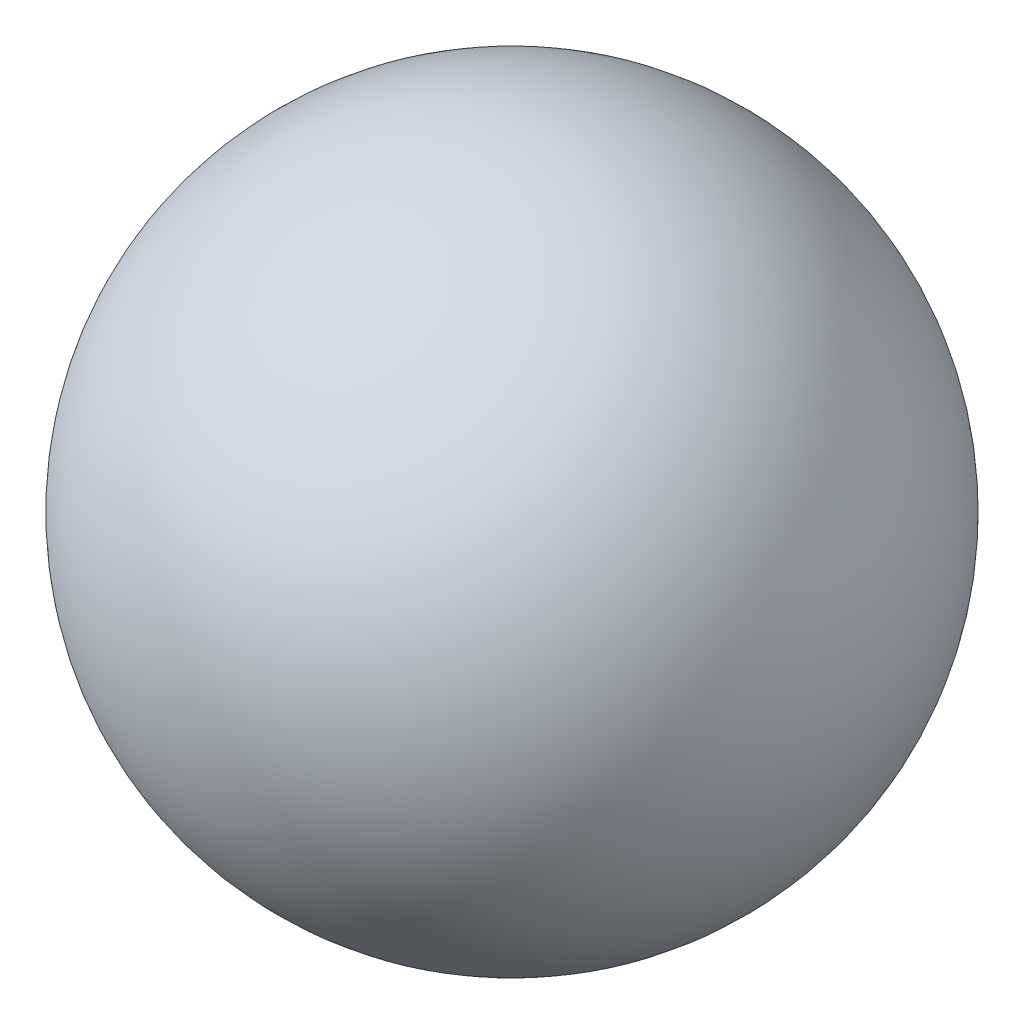
from build123d import *


with BuildPart() as part:
    # Sketch1 → Revolve1 (revolve)
    with BuildSketch(Plane.XY):
        with BuildLine():
            Line((0, 65), (0, -65))
            ThreePointArc((0, -65), (65, 0), (0, 65))
        make_face()
    revolve(axis=Axis((0, -65, 0), (0, 1, 0)))


solid = part.part
